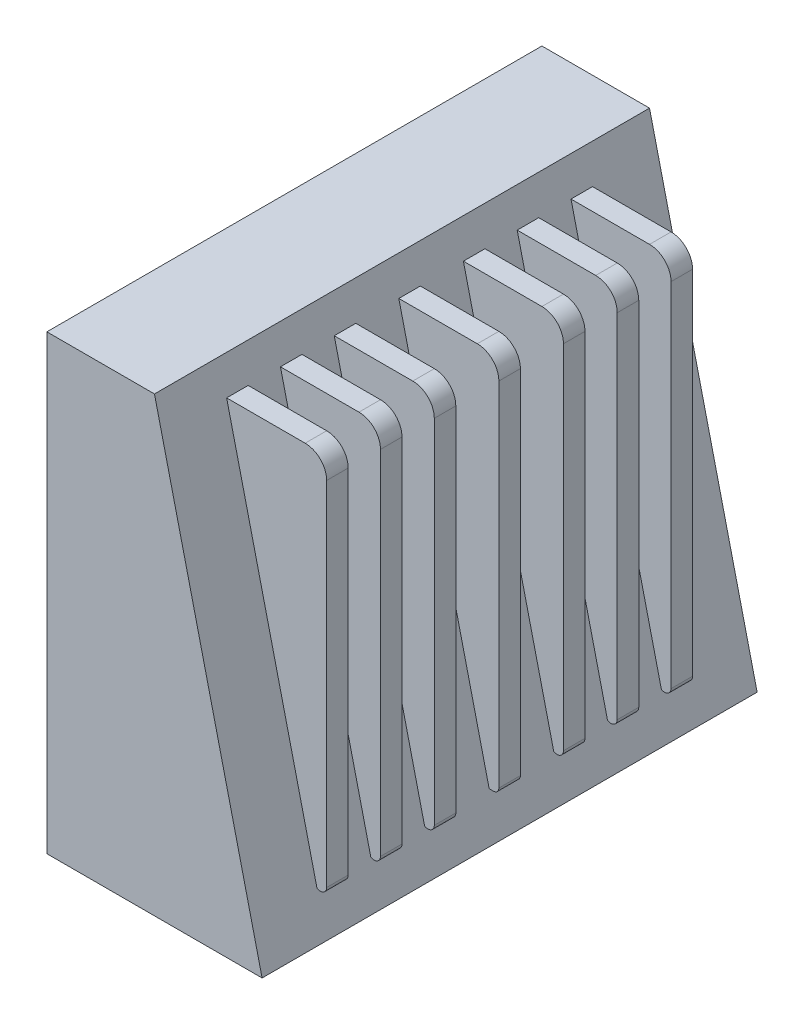
from build123d import *

# Parameters (mm, degrees)
CROQUIS1_W               = 20
CROQUIS1_H               = 46
SALIENTE_EXTRUIR1_DEPTH  = 42
CORTAR_EXTRUIR1_DEPTH    = 64.087241182
SALIENTE_EXTRUIR4_DEPTH  = 1
SALIENTE_EXTRUIR5_DEPTH  = 1
SALIENTE_EXTRUIR6_DEPTH  = 1
SALIENTE_EXTRUIR7_DEPTH  = 1
SALIENTE_EXTRUIR8_DEPTH  = 1
SALIENTE_EXTRUIR9_DEPTH  = 1
SALIENTE_EXTRUIR10_DEPTH = 1


with BuildPart() as part:
    # Croquis1 → Saliente-Extruir1 (new body)
    with BuildSketch(Plane(origin=(0, 0, 0), x_dir=(1, 0, 0), z_dir=(0, 1, 0))):
        Rectangle(CROQUIS1_W, CROQUIS1_H)
    extrude(amount=SALIENTE_EXTRUIR1_DEPTH)

    # Croquis2 → Cortar-Extruir1 (cut, through all)
    with BuildSketch(Plane.XY.offset(23)):
        Polygon((10, 0), (-0.19167841, 42.803384109), (10, 42), align=None)
    extrude(amount=-CORTAR_EXTRUIR1_DEPTH, mode=Mode.SUBTRACT)

    # Croquis3 → Saliente-Extruir4 (add, symmetric)
    with BuildSketch(Plane.XY):
        with BuildLine():
            Line((9.099065282, 3.783778611), (9.5, 3.783778611))
            ThreePointArc((9.5, 3.783778611), (9.853553391, 3.93022522), (10, 4.283778611))
            Line((10, 4.283778611), (10, 37.037089462))
            ThreePointArc((10, 37.037089462), (9.414213562, 38.451303024), (8, 39.037089462))
            Line((8, 39.037089462), (0.705093297, 39.037089462))
            Line((0.705093297, 39.037089462), (9.099065282, 3.783778611))
        make_face()
    extrude(amount=SALIENTE_EXTRUIR4_DEPTH, both=True)

    # Croquis5 → Saliente-Extruir5 (add, symmetric)
    with BuildSketch(Plane.XY.offset(6)):
        with BuildLine():
            Line((0.705093297, 39.037089462), (8, 39.037089462))
            ThreePointArc((8, 39.037089462), (9.414213562, 38.451303024), (10, 37.037089462))
            Line((10, 37.037089462), (10, 4.283778611))
            ThreePointArc((10, 4.283778611), (9.696707623, 3.768588508), (9.099065282, 3.783778611))
            Line((9.099065282, 3.783778611), (0.705093297, 39.037089462))
        make_face()
    extrude(amount=SALIENTE_EXTRUIR5_DEPTH, both=True)

    # Croquis6 → Saliente-Extruir6 (add, symmetric)
    with BuildSketch(Plane.XY.offset(11)):
        with BuildLine():
            Line((0.705093297, 39.037089462), (8, 39.037089462))
            ThreePointArc((8, 39.037089462), (9.414213562, 38.451303024), (10, 37.037089462))
            Line((10, 37.037089462), (10, 4.283778611))
            ThreePointArc((10, 4.283778611), (9.696707623, 3.768588508), (9.099065282, 3.783778611))
            Line((9.099065282, 3.783778611), (0.705093297, 39.037089462))
        make_face()
    extrude(amount=SALIENTE_EXTRUIR6_DEPTH, both=True)

    # Croquis7 → Saliente-Extruir7 (add, symmetric)
    with BuildSketch(Plane.XY.offset(16)):
        with BuildLine():
            Line((0.705093297, 39.037089462), (8, 39.037089462))
            ThreePointArc((8, 39.037089462), (9.414213562, 38.451303024), (10, 37.037089462))
            Line((10, 37.037089462), (10, 4.283778611))
            ThreePointArc((10, 4.283778611), (9.251976893, 3.716372197), (8.907184659, 4.589645878))
            Line((8.907184659, 4.589645878), (0.705093297, 39.037089462))
        make_face()
    extrude(amount=SALIENTE_EXTRUIR7_DEPTH, both=True)

    # Croquis9 → Saliente-Extruir8 (add, symmetric)
    with BuildSketch(Plane(origin=(0, 0, -6), x_dir=(-1, 0, 0), z_dir=(0, 0, -1))):
        with BuildLine():
            Line((-0.705093297, 39.037089462), (-8, 39.037089462))
            ThreePointArc((-8, 39.037089462), (-9.414213562, 38.451303024), (-10, 37.037089462))
            Line((-10, 37.037089462), (-10, 4.283778611))
            ThreePointArc((-10, 4.283778611), (-9.696707623, 3.768588508), (-9.099065282, 3.783778611))
            Line((-9.099065282, 3.783778611), (-0.705093297, 39.037089462))
        make_face()
    extrude(amount=SALIENTE_EXTRUIR8_DEPTH, both=True)

    # Croquis10 → Saliente-Extruir9 (add, symmetric)
    with BuildSketch(Plane(origin=(0, 0, -11), x_dir=(-1, 0, 0), z_dir=(0, 0, -1))):
        with BuildLine():
            Line((-0.705093297, 39.037089462), (-8, 39.037089462))
            ThreePointArc((-8, 39.037089462), (-9.414213562, 38.451303024), (-10, 37.037089462))
            Line((-10, 37.037089462), (-10, 4.283778611))
            ThreePointArc((-10, 4.283778611), (-9.696707623, 3.768588508), (-9.099065282, 3.783778611))
            Line((-9.099065282, 3.783778611), (-8.907184659, 4.589645878))
            Line((-8.907184659, 4.589645878), (-0.705093297, 39.037089462))
        make_face()
    extrude(amount=SALIENTE_EXTRUIR9_DEPTH, both=True)

    # Croquis11 → Saliente-Extruir10 (add, symmetric)
    with BuildSketch(Plane(origin=(0, 0, -16), x_dir=(-1, 0, 0), z_dir=(0, 0, -1))):
        with BuildLine():
            Line((-0.705093297, 39.037089462), (-8, 39.037089462))
            ThreePointArc((-8, 39.037089462), (-9.414213562, 38.451303024), (-10, 37.037089462))
            Line((-10, 37.037089462), (-10, 4.283778611))
            ThreePointArc((-10, 4.283778611), (-9.696707623, 3.768588508), (-9.099065282, 3.783778611))
            Line((-9.099065282, 3.783778611), (-0.705093297, 39.037089462))
        make_face()
    extrude(amount=SALIENTE_EXTRUIR10_DEPTH, both=True)


solid = part.part
